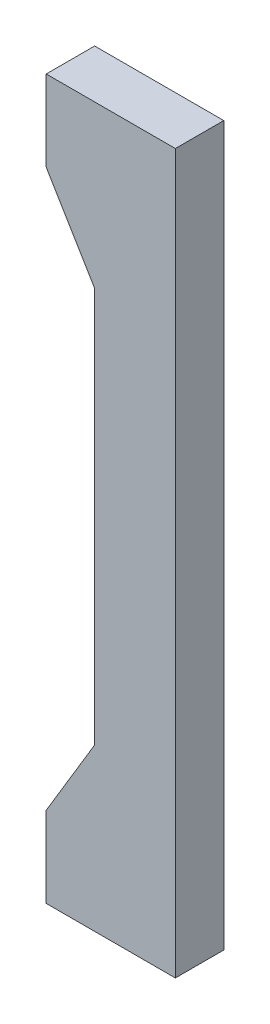
from build123d import *

# Parameters (mm, degrees)
BOSS_EXTRUDE1_DEPTH = 15


with BuildPart() as part:
    # Sketch1 → Boss-Extrude1 (new, symmetric)
    with BuildSketch(Plane.XY):
        Polygon((-80, 222.5), (0, 222.5), (0, -222.5), (-80, -222.5), (-80, -172.5), (-50, -122.5), (-50, 122.5), (-80, 172.5), align=None)
    extrude(amount=BOSS_EXTRUDE1_DEPTH, both=True)


solid = part.part
